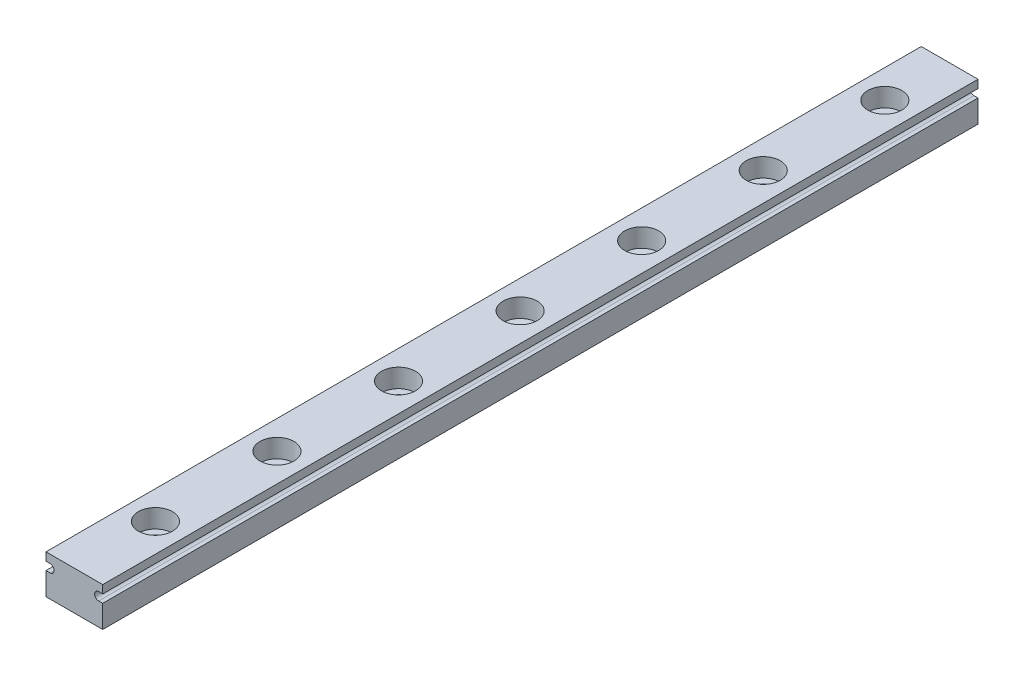
from build123d import *

# Parameters (mm, degrees)
BOSS_EXTRUDE1_DEPTH = 108
LPATTERN1_COUNT     = 7
LPATTERN1_PITCH     = 15


with BuildPart() as part:
    # Sketch1 → Boss-Extrude1 (new body)
    with BuildSketch(Plane.XY):
        with BuildLine():
            Line((-3.5, 0), (3.5, 0))
            Line((3.5, 0), (3.5, 2.8))
            Line((3.5, 2.8), (3, 2.8))
            ThreePointArc((3, 2.8), (2.5, 3.3), (3, 3.8))
            Line((3, 3.8), (3.5, 3.8))
            Line((3.5, 3.8), (3.5, 4.8))
            Line((3.5, 4.8), (-3.5, 4.8))
            Line((-3.5, 4.8), (-3.5, 3.8))
            Line((-3.5, 3.8), (-3, 3.8))
            ThreePointArc((-3, 3.8), (-2.5, 3.3), (-3, 2.8))
            Line((-3, 2.8), (-3.5, 2.8))
            Line((-3.5, 2.8), (-3.5, 0))
        make_face()
    extrude(amount=-BOSS_EXTRUDE1_DEPTH)

    # Sketch2 → Cut-Revolve1 (revolve, cut)
    with BuildSketch(Plane(origin=(0, 0, 0), x_dir=(0, 0, -1), z_dir=(1, 0, 0))):
        Polygon((7.9, 4.8), (7.9, 2.5), (8.8, 2.5), (8.8, 0), (10, 0), (10, 4.8), align=None)
    cut_revolve1 = revolve(axis=Axis((0, 4.8, -10), (0, -1, 0)), mode=Mode.SUBTRACT)

    # LPattern1: Cut-Revolve1 ×7
    with Locations(*[(0, 0, -i * LPATTERN1_PITCH) for i in range(1, LPATTERN1_COUNT)]):
        add(cut_revolve1, mode=Mode.SUBTRACT)


solid = part.part
